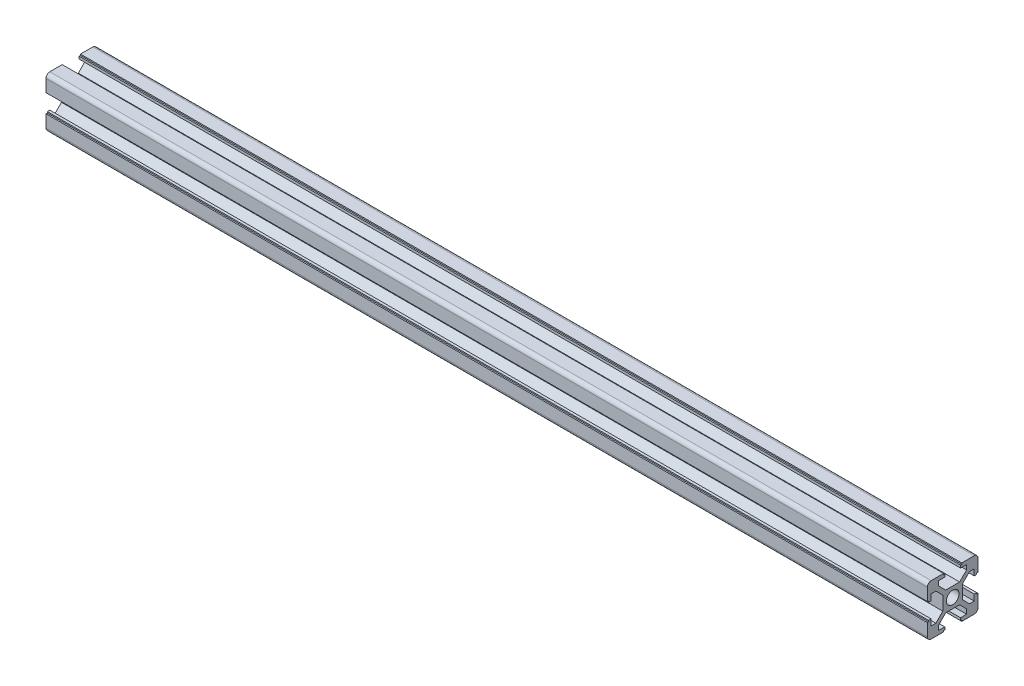
from build123d import *

# Parameters (mm, degrees)
SKETCH1_R                = 2.5
F_20_X_20_X_R1_5_1_DEPTH = 348


with BuildPart() as part:
    # Sketch1 → 铝型材 20 X 20 X R1.5(1) (new body)
    with BuildSketch(Plane(origin=(0, 0, 0), x_dir=(0, 0, -1), z_dir=(1, 0, 0))):
        with BuildLine():
            Line((-3.6, 10), (-3.6, 9.5))
            Line((-3.6, 9.5), (-3.1, 9.5))
            Line((-3.1, 9.5), (-3.1, 8.5))
            Line((-3.1, 8.5), (-5.5, 8.5))
            Line((-5.5, 8.5), (-5.5, 6.65))
            Line((-5.5, 6.65), (-2.75, 3.9))
            Line((-2.75, 3.9), (2.75, 3.9))
            Line((2.75, 3.9), (5.5, 6.65))
            Line((5.5, 6.65), (5.5, 8.5))
            Line((5.5, 8.5), (3.1, 8.5))
            Line((3.1, 8.5), (3.1, 9.5))
            Line((3.1, 9.5), (3.6, 9.5))
            Line((3.6, 9.5), (3.6, 10))
            Line((3.6, 10), (8.5, 10))
            ThreePointArc((8.5, 10), (9.560660172, 9.560660172), (10, 8.5))
            Line((10, 8.5), (10, 3.6))
            Line((10, 3.6), (9.5, 3.6))
            Line((9.5, 3.6), (9.5, 3.1))
            Line((9.5, 3.1), (8.5, 3.1))
            Line((8.5, 3.1), (8.5, 5.5))
            Line((8.5, 5.5), (6.65, 5.5))
            Line((6.65, 5.5), (3.9, 2.75))
            Line((3.9, 2.75), (3.9, -2.75))
            Line((3.9, -2.75), (6.65, -5.5))
            Line((6.65, -5.5), (8.5, -5.5))
            Line((8.5, -5.5), (8.5, -3.1))
            Line((8.5, -3.1), (9.5, -3.1))
            Line((9.5, -3.1), (9.5, -3.6))
            Line((9.5, -3.6), (10, -3.6))
            Line((10, -3.6), (10, -8.5))
            ThreePointArc((10, -8.5), (9.560660172, -9.560660172), (8.5, -10))
            Line((8.5, -10), (3.6, -10))
            Line((3.6, -10), (3.6, -9.5))
            Line((3.6, -9.5), (3.1, -9.5))
            Line((3.1, -9.5), (3.1, -8.5))
            Line((3.1, -8.5), (5.5, -8.5))
            Line((5.5, -8.5), (5.5, -6.65))
            Line((5.5, -6.65), (2.75, -3.9))
            Line((2.75, -3.9), (-2.75, -3.9))
            Line((-2.75, -3.9), (-5.5, -6.65))
            Line((-5.5, -6.65), (-5.5, -8.5))
            Line((-5.5, -8.5), (-3.1, -8.5))
            Line((-3.1, -8.5), (-3.1, -9.5))
            Line((-3.1, -9.5), (-3.6, -9.5))
            Line((-3.6, -9.5), (-3.6, -10))
            Line((-3.6, -10), (-8.5, -10))
            ThreePointArc((-8.5, -10), (-9.560660172, -9.560660172), (-10, -8.5))
            Line((-10, -8.5), (-10, -3.6))
            Line((-10, -3.6), (-9.5, -3.6))
            Line((-9.5, -3.6), (-9.5, -3.1))
            Line((-9.5, -3.1), (-8.5, -3.1))
            Line((-8.5, -3.1), (-8.5, -5.5))
            Line((-8.5, -5.5), (-6.65, -5.5))
            Line((-6.65, -5.5), (-3.9, -2.75))
            Line((-3.9, -2.75), (-3.9, 2.75))
            Line((-3.9, 2.75), (-6.65, 5.5))
            Line((-6.65, 5.5), (-8.5, 5.5))
            Line((-8.5, 5.5), (-8.5, 3.1))
            Line((-8.5, 3.1), (-9.5, 3.1))
            Line((-9.5, 3.1), (-9.5, 3.6))
            Line((-9.5, 3.6), (-10, 3.6))
            Line((-10, 3.6), (-10, 8.5))
            ThreePointArc((-10, 8.5), (-9.560660172, 9.560660172), (-8.5, 10))
            Line((-8.5, 10), (-3.6, 10))
        make_face()
        Circle(SKETCH1_R, mode=Mode.SUBTRACT)
    extrude(amount=F_20_X_20_X_R1_5_1_DEPTH)


solid = part.part
